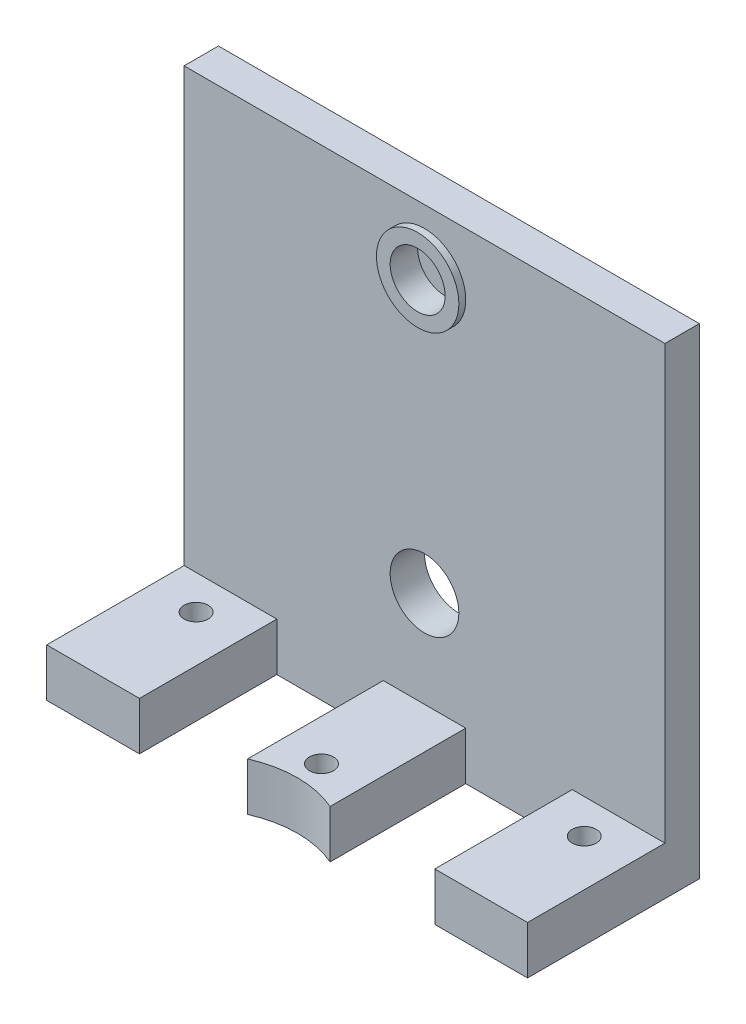
from build123d import *

# Parameters (mm, degrees)
SKETCH1_W           = 70
SKETCH1_H           = 70
SKETCH1_R           = 5
BOSS_EXTRUDE1_DEPTH = 5
SKETCH2_W           = 13.5
SKETCH2_H           = 7
SKETCH2_W_2         = 12
BOSS_EXTRUDE2_DEPTH = 20
SKETCH3_R           = 1.75
CUT_EXTRUDE1_DEPTH  = 20
SKETCH4_R           = 4
CUT_EXTRUDE2_DEPTH  = 3
BOSS_EXTRUDE3_START = 1
SKETCH5_R           = 6
SKETCH5_R_2         = 4
BOSS_EXTRUDE3_DEPTH = 1
SKETCH6_R           = 15
CUT_EXTRUDE3_DEPTH  = 83.158383626


with BuildPart() as part:
    # Sketch1 → Boss-Extrude1 (new body)
    with BuildSketch(Plane.XY):
        Rectangle(SKETCH1_W, SKETCH1_H)
        with Locations((0, -14)):
            Circle(SKETCH1_R, mode=Mode.SUBTRACT)
    extrude(amount=BOSS_EXTRUDE1_DEPTH)

    # Sketch2 → Boss-Extrude2 (add)
    with BuildSketch(Plane.XY.offset(5)):
        with Locations((-28.25, -31.5)):
            Rectangle(SKETCH2_W, SKETCH2_H)
        with Locations((28.25, -31.5)):
            Rectangle(SKETCH2_W, SKETCH2_H)
        with Locations((0, -31.5)):
            Rectangle(SKETCH2_W_2, SKETCH2_H)
    extrude(amount=BOSS_EXTRUDE2_DEPTH)

    # Sketch3 → Cut-Extrude1 (cut)
    with BuildSketch(Plane(origin=(0, -28, 0), x_dir=(1, 0, 0), z_dir=(0, 1, 0))):
        with Locations(Location((-28.25, -10, 0), (0, 0, 270))):
            Circle(SKETCH3_R)
        with Locations(Location((28.25, -10, 0), (0, 0, 270))):
            Circle(SKETCH3_R)
        with Locations(Location((0, -20, 0), (0, 0, 270))):
            Circle(SKETCH3_R)
    extrude(amount=-CUT_EXTRUDE1_DEPTH, mode=Mode.SUBTRACT)

    # Sketch4 → Cut-Extrude2 (cut)
    with BuildSketch(Plane.XY.offset(5)):
        with Locations((0, 26)):
            Circle(SKETCH4_R)
    extrude(amount=-CUT_EXTRUDE2_DEPTH, mode=Mode.SUBTRACT)

    # Sketch5 → Boss-Extrude3 (add)
    with BuildSketch(Plane.XY.offset(5).offset(BOSS_EXTRUDE3_START)):
        with Locations((0, 26)):
            Circle(SKETCH5_R)
        with Locations((0, 26)):
            Circle(SKETCH5_R_2, mode=Mode.SUBTRACT)
    extrude(amount=-BOSS_EXTRUDE3_DEPTH)

    # Sketch6 → Cut-Extrude3 (cut, through all)
    with BuildSketch(Plane.XZ.offset(35)):
        with Locations((0, 38.5)):
            Circle(SKETCH6_R)
    extrude(amount=-CUT_EXTRUDE3_DEPTH, mode=Mode.SUBTRACT)


solid = part.part
